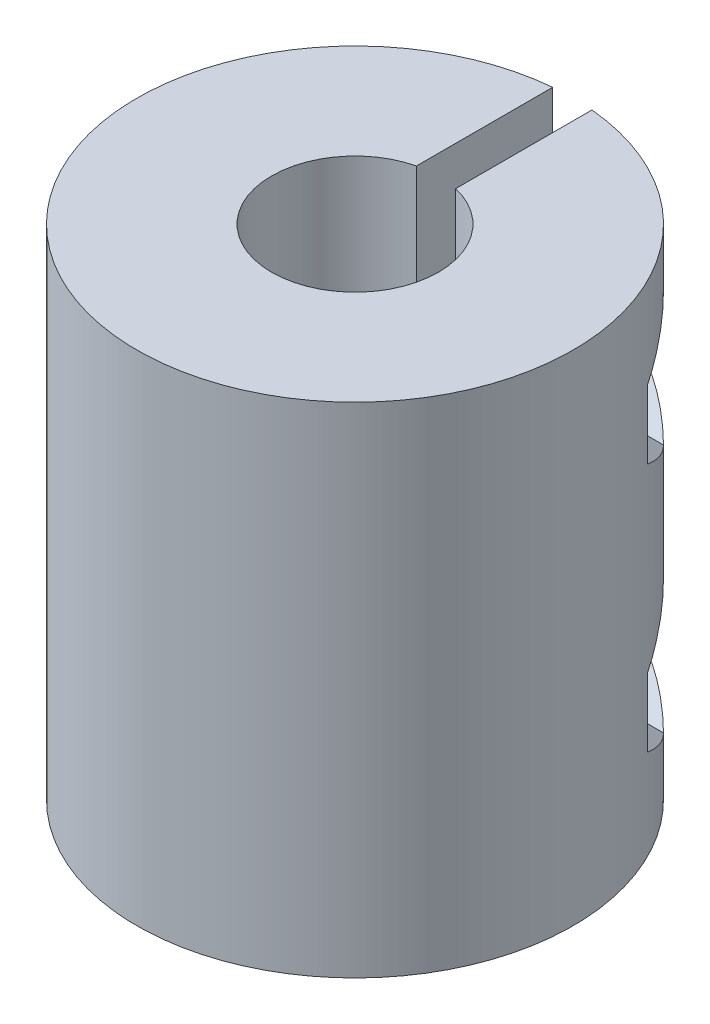
from build123d import *

# Parameters (mm, degrees)
SKETCH1_R                           = 11.1125
BOSS_EXTRUDE1_DEPTH                 = 12.7
CUT_EXTRUDE1_START                  = -12.7
SKETCH2_R                           = 4.25
CUT_EXTRUDE1_DEPTH                  = 12.7
CUT_EXTRUDE2_START                  = -12.7
SKETCH3_R                           = 4.8895
CUT_EXTRUDE2_DEPTH                  = 12.7
CUT_EXTRUDE3_REACH                  = 31.869
CUT_EXTRUDE4_DEPTH                  = 4
CUT_EXTRUDE4_DIRECTION_2_REACH      = 26.756
CUT_EXTRUDE4_DIRECTION_2_END_RADIUS = 11.1125
M3_CLEARANCE_HOLE1_D                = 3.4
CUT_EXTRUDE5_REACH                  = 23.999
SKETCH9_R                           = 3.5


with BuildPart() as part:
    # Sketch1 → Boss-Extrude1 (new, symmetric)
    with BuildSketch(Plane(origin=(0, 0, 0), x_dir=(1, 0, 0), z_dir=(0, 1, 0))):
        with Locations(Location((0, 0, 0), (0, 0, 270))):
            Circle(SKETCH1_R)
    extrude(amount=BOSS_EXTRUDE1_DEPTH, both=True)

    # Sketch2 → Cut-Extrude1 (cut)
    with BuildSketch(Plane(origin=(0, 12.7, 0), x_dir=(1, 0, 0), z_dir=(0, 1, 0)).offset(CUT_EXTRUDE1_START)):
        with Locations(Location((0, 0, 0), (0, 0, 270))):
            Circle(SKETCH2_R)
    extrude(amount=CUT_EXTRUDE1_DEPTH, mode=Mode.SUBTRACT)

    # Sketch3 → Cut-Extrude2 (cut)
    with BuildSketch(Plane.XZ.offset(12.7).offset(CUT_EXTRUDE2_START)):
        with Locations(Location((0, 0, 0), (0, 0, 270))):
            Circle(SKETCH3_R)
    extrude(amount=CUT_EXTRUDE2_DEPTH, mode=Mode.SUBTRACT)

    # Sketch4 → Cut-Extrude3 (cut, up to next)
    with BuildSketch(Plane(origin=(0, 12.7, 0), x_dir=(1, 0, 0), z_dir=(0, 1, 0)), mode=Mode.PRIVATE) as cut_extrude3_sk1:
        with BuildLine():
            Line((-1, 4.13067791), (-1, 11.067414163))
            ThreePointArc((-1, 11.067414163), (0, 11.1125), (1, 11.067414163))
            Line((1, 11.067414163), (1, 4.13067791))
            ThreePointArc((1, 4.13067791), (0, 4.25), (-1, 4.13067791))
        make_face()
    cut_extrude3_tool1 = extrude(cut_extrude3_sk1.sketch, amount=-CUT_EXTRUDE3_REACH, mode=Mode.PRIVATE) & part.part
    add(cut_extrude3_tool1.solids().sort_by_distance((0, 12.7, -7.653889))[0], mode=Mode.SUBTRACT)

    # Sketch5 → Cut-Extrude4 (cut)
    with BuildSketch(Plane(origin=(7, 0, 0), x_dir=(0, 0, -1), z_dir=(1, 0, 0))):
        Polygon((7.926780955, 2.885898385), (10.926780955, 4.617949192), (10.926780955, 8.082050808), (7.926780955, 9.814101615), (4.926780955, 8.082050808), (4.926780955, 4.617949192), align=None)
        Polygon((7.926780955, -9.814101615), (10.926780955, -8.082050808), (10.926780955, -4.617949192), (7.926780955, -2.885898385), (4.926780955, -4.617949192), (4.926780955, -8.082050808), align=None)
    extrude(amount=-CUT_EXTRUDE4_DEPTH, mode=Mode.SUBTRACT)

    # Cut-Extrude4 direction 2: up to this cylinder (the profile starts inside it)
    cut_extrude4_direction_2_end = Plane(origin=(0, 0, 0), z_dir=(0, -1, 0)) * Cylinder(CUT_EXTRUDE4_DIRECTION_2_END_RADIUS, 89.437, mode=Mode.PRIVATE)
    # Sketch5 → Cut-Extrude4 direction 2 (cut, up to the surface)
    with BuildSketch(Plane(origin=(7, 0, 0), x_dir=(0, 0, -1), z_dir=(1, 0, 0)), mode=Mode.PRIVATE) as cut_extrude4_direction_2_sk1:
        Polygon((7.926780955, 2.885898385), (10.926780955, 4.617949192), (10.926780955, 8.082050808), (7.926780955, 9.814101615), (4.926780955, 8.082050808), (4.926780955, 4.617949192), align=None)
    cut_extrude4_direction_2_tool1 = extrude(cut_extrude4_direction_2_sk1.sketch, amount=CUT_EXTRUDE4_DIRECTION_2_REACH, mode=Mode.PRIVATE) & cut_extrude4_direction_2_end
    add(cut_extrude4_direction_2_tool1.solids().sort_by_distance((7, 6.35, -7.926781))[0], mode=Mode.SUBTRACT)
    # Sketch5 → Cut-Extrude4 direction 2 (cut, up to the surface)
    with BuildSketch(Plane(origin=(7, 0, 0), x_dir=(0, 0, -1), z_dir=(1, 0, 0)), mode=Mode.PRIVATE) as cut_extrude4_direction_2_sk2:
        Polygon((7.926780955, -9.814101615), (10.926780955, -8.082050808), (10.926780955, -4.617949192), (7.926780955, -2.885898385), (4.926780955, -4.617949192), (4.926780955, -8.082050808), align=None)
    cut_extrude4_direction_2_tool2 = extrude(cut_extrude4_direction_2_sk2.sketch, amount=CUT_EXTRUDE4_DIRECTION_2_REACH, mode=Mode.PRIVATE) & cut_extrude4_direction_2_end
    add(cut_extrude4_direction_2_tool2.solids().sort_by_distance((7, -6.35, -7.926781))[0], mode=Mode.SUBTRACT)

    # M3 Clearance Hole1 (through all)
    with Locations(Plane(origin=(3, 0, 0), x_dir=(0, 0, -1), z_dir=(1, 0, 0))):
        with Locations((7.926780955, 6.35), (7.926780955, -6.35)):
            Hole(M3_CLEARANCE_HOLE1_D / 2)

    # Sketch9 → Cut-Extrude5 (cut, up to next)
    with BuildSketch(Plane(origin=(-3, 0, 0), x_dir=(0, 0, -1), z_dir=(1, 0, 0)), mode=Mode.PRIVATE) as cut_extrude5_sk1:
        with Locations((7.926780955, 6.35)):
            Circle(SKETCH9_R)
    cut_extrude5_tool1 = extrude(cut_extrude5_sk1.sketch, amount=-CUT_EXTRUDE5_REACH, mode=Mode.PRIVATE) & part.part
    # Sketch9 → Cut-Extrude5 (cut, up to next)
    with BuildSketch(Plane(origin=(-3, 0, 0), x_dir=(0, 0, -1), z_dir=(1, 0, 0)), mode=Mode.PRIVATE) as cut_extrude5_sk2:
        with Locations((7.926780955, -6.35)):
            Circle(SKETCH9_R)
    cut_extrude5_tool2 = extrude(cut_extrude5_sk2.sketch, amount=-CUT_EXTRUDE5_REACH, mode=Mode.PRIVATE) & part.part
    add(cut_extrude5_tool1.solids().sort_by_distance((-3, 6.35, -7.926781))[0], mode=Mode.SUBTRACT)
    add(cut_extrude5_tool2.solids().sort_by_distance((-3, -6.35, -7.926781))[0], mode=Mode.SUBTRACT)


solid = part.part
